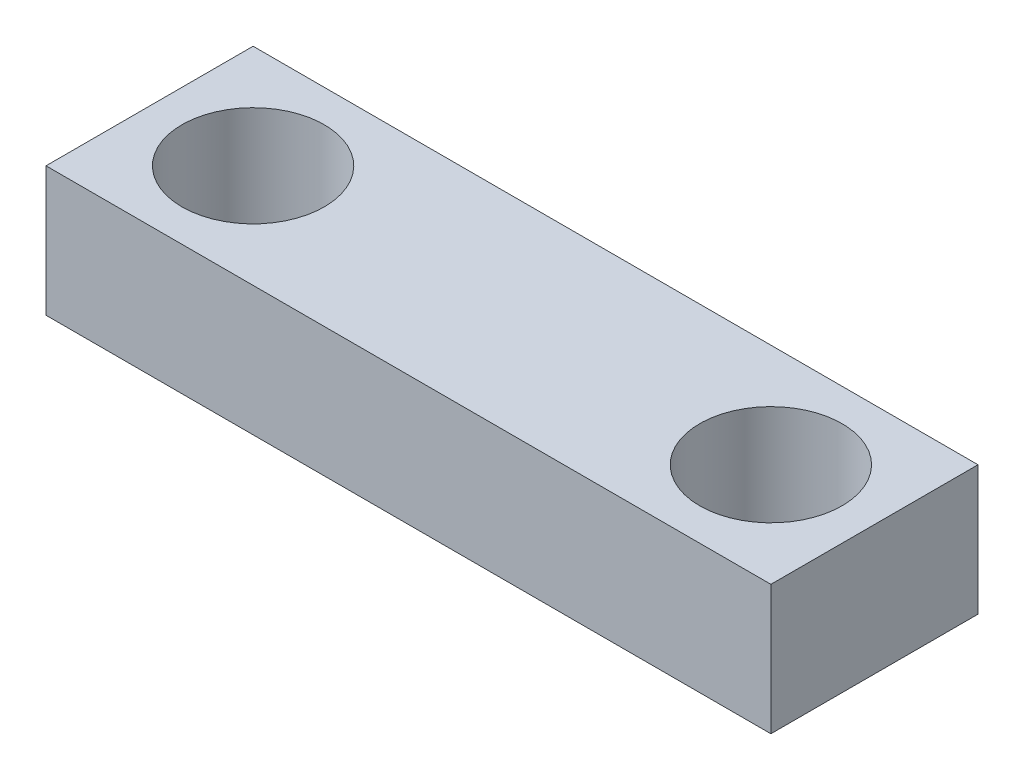
from build123d import *

# Parameters (mm, degrees)
SKETCH2_W           = 28
SKETCH2_H           = 8
SKETCH2_R           = 2.75
BOSS_EXTRUDE1_DEPTH = 5


with BuildPart() as part:
    # Sketch2 → Boss-Extrude1 (new body)
    with BuildSketch(Plane(origin=(0, 0, 0), x_dir=(1, 0, 0), z_dir=(0, 1, 0))):
        Rectangle(SKETCH2_W, SKETCH2_H)
        with Locations(Location((10, 0, 0), (0, 0, 270))):
            Circle(SKETCH2_R, mode=Mode.SUBTRACT)
        with Locations(Location((-10, 0, 0), (0, 0, 270))):
            Circle(SKETCH2_R, mode=Mode.SUBTRACT)
    extrude(amount=BOSS_EXTRUDE1_DEPTH)


solid = part.part
